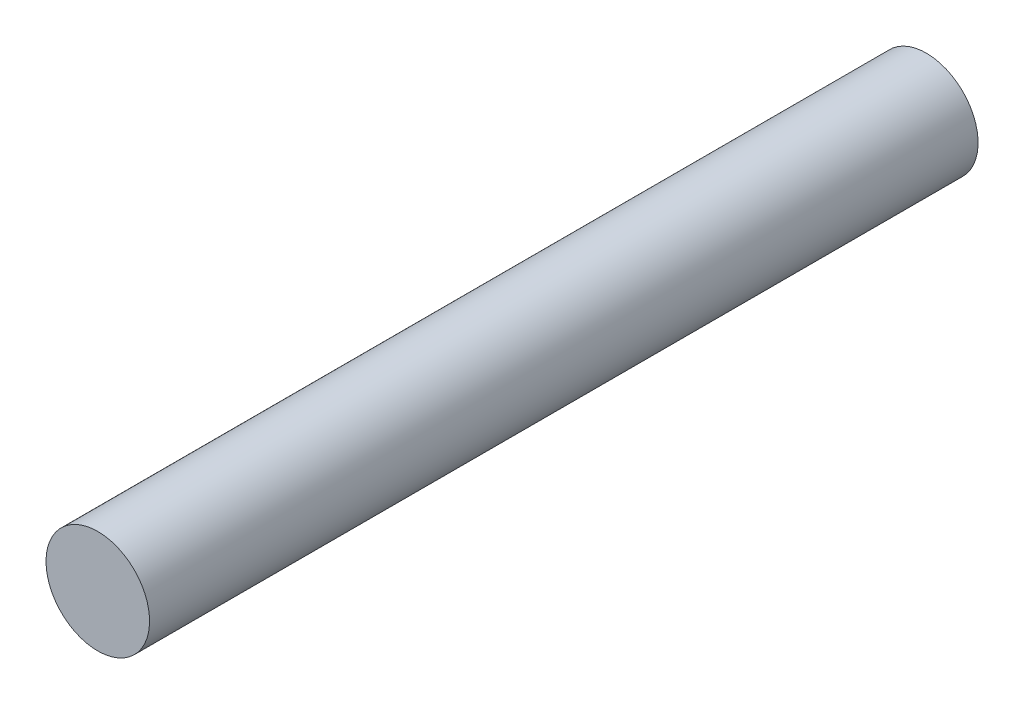
from build123d import *

# Parameters (mm, degrees)
SKETCH1_R           = 4.7625
BOSS_EXTRUDE1_DEPTH = 38.1


with BuildPart() as part:
    # Sketch1 → Boss-Extrude1 (new, symmetric)
    with BuildSketch(Plane.XY):
        with Locations(Location((0, 0, 0), (0, 0, 180))):
            Circle(SKETCH1_R)
    extrude(amount=BOSS_EXTRUDE1_DEPTH, both=True)


solid = part.part
